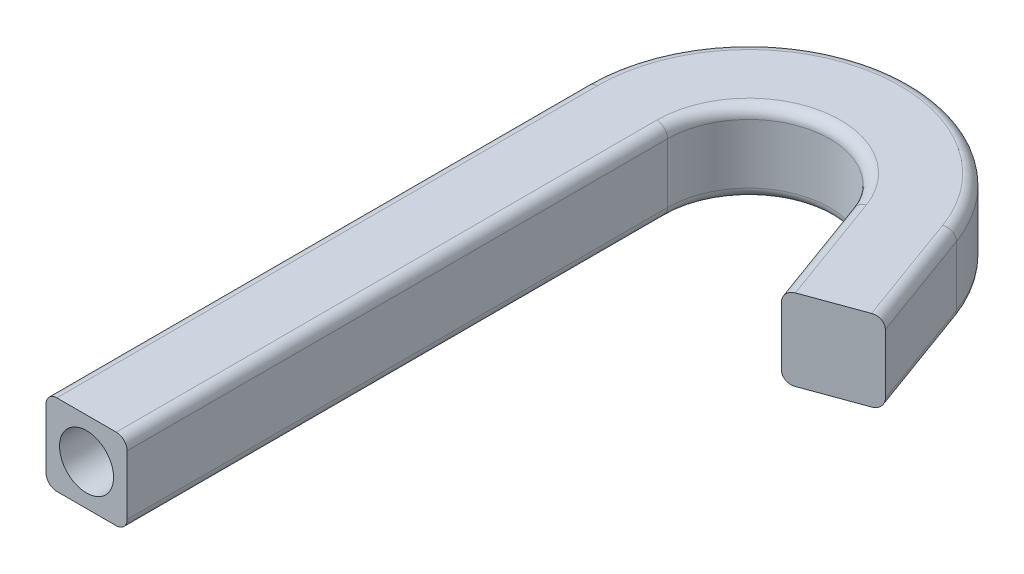
from build123d import *

# Parameters (mm, degrees)
BOSS_EXTRUDE1_DEPTH = 19.05
SKETCH9_R           = 6.35
CUT_EXTRUDE2_DEPTH  = 34.29
FILLET1_R           = 2.54


with BuildPart() as part:
    # Sketch1 → Boss-Extrude1 (new body)
    with BuildSketch(Plane(origin=(0, 0, 0), x_dir=(1, 0, 0), z_dir=(0, 1, 0))):
        with BuildLine():
            Line((27.462285602, -19.753535756), (45.363430028, -13.238052025))
            Line((45.363430028, -13.238052025), (35.802288852, 13.030967461))
            ThreePointArc((35.802288852, 13.030967461), (-6.615995569, 37.52117539), (-38.1, 0))
            Line((-38.1, 0), (-38.1, -127))
            Line((-38.1, -127), (-19.05, -127))
            Line((-19.05, -127), (-19.05, 0))
            ThreePointArc((-19.05, 0), (-3.307997785, 18.760587695), (17.901144426, 6.51548373))
            Line((17.901144426, 6.51548373), (27.462285602, -19.753535756))
        make_face()
    extrude(amount=BOSS_EXTRUDE1_DEPTH)

    # Sketch9 → Cut-Extrude2 (cut)
    with BuildSketch(Plane.XY.offset(127)):
        with Locations((-28.575, 9.525)):
            Circle(SKETCH9_R)
    extrude(amount=-CUT_EXTRUDE2_DEPTH, mode=Mode.SUBTRACT)

    # Fillet1
    fillet1_edges = [part.edges().sort_by_distance(p)[0] for p in [
        (40.58285944, 19.05, 0.103542282),
        (22.681715014, 0, 6.619026013),
        (-6.615995569, 19.05, -37.52117539),
        (-38.1, 19.05, 63.5),
        (-19.05, 19.05, 63.5),
        (-3.307997785, 19.05, -18.760587695),
        (22.681715014, 19.05, 6.619026013),
        (-3.307997785, 0, -18.760587695),
        (-19.05, 0, 63.5),
        (-38.1, 0, 63.5),
        (-6.615995569, 0, -37.52117539),
        (40.58285944, 0, 0.103542282),
    ]]
    fillet(fillet1_edges, radius=FILLET1_R)


solid = part.part
